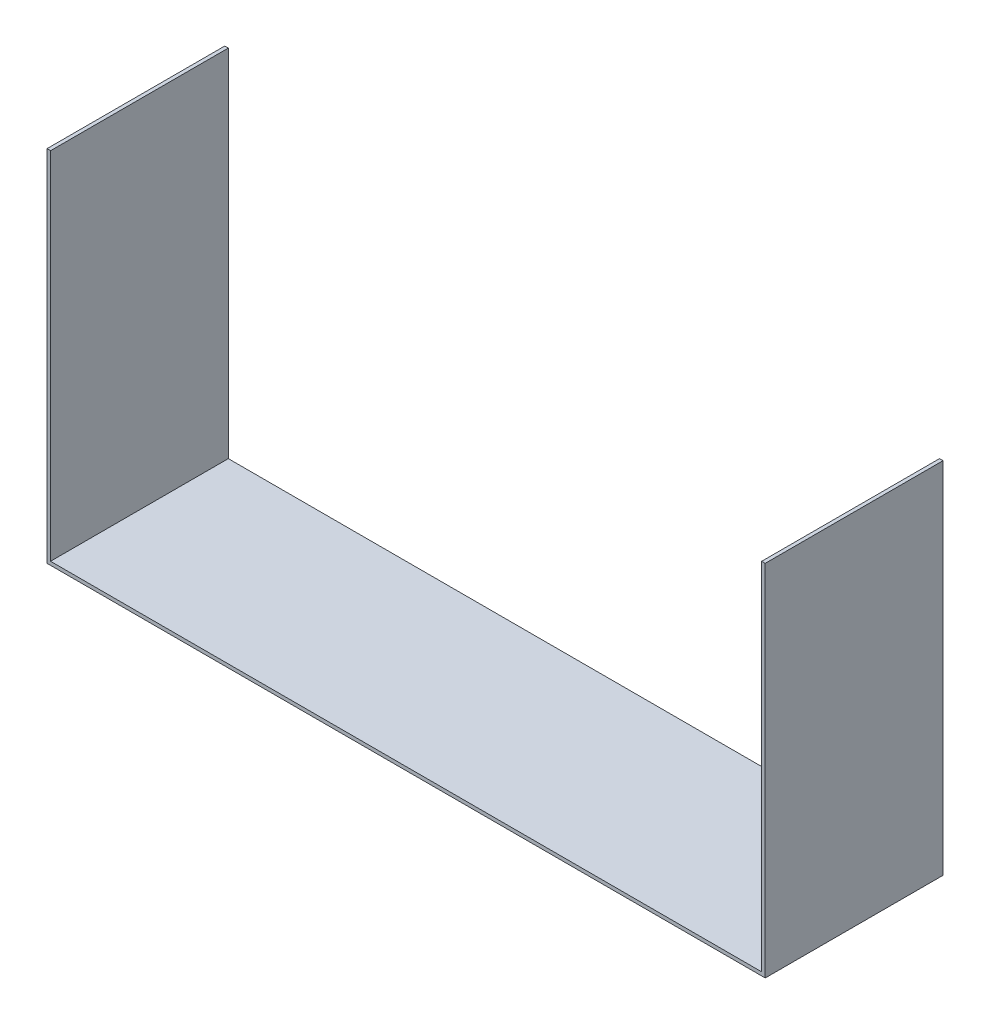
from build123d import *

# Parameters (mm, degrees)
BOSS_EXTRUDE1_DEPTH = 10000


with BuildPart() as part:
    # Sketch1 → Boss-Extrude1 (new body)
    with BuildSketch(Plane.XY):
        Polygon((0, 0), (0, -20000), (40000, -20000), (40000, 0), (40200, 0), (40200, -20200), (-200, -20200), (-200, 0), align=None)
    extrude(amount=BOSS_EXTRUDE1_DEPTH)


solid = part.part
